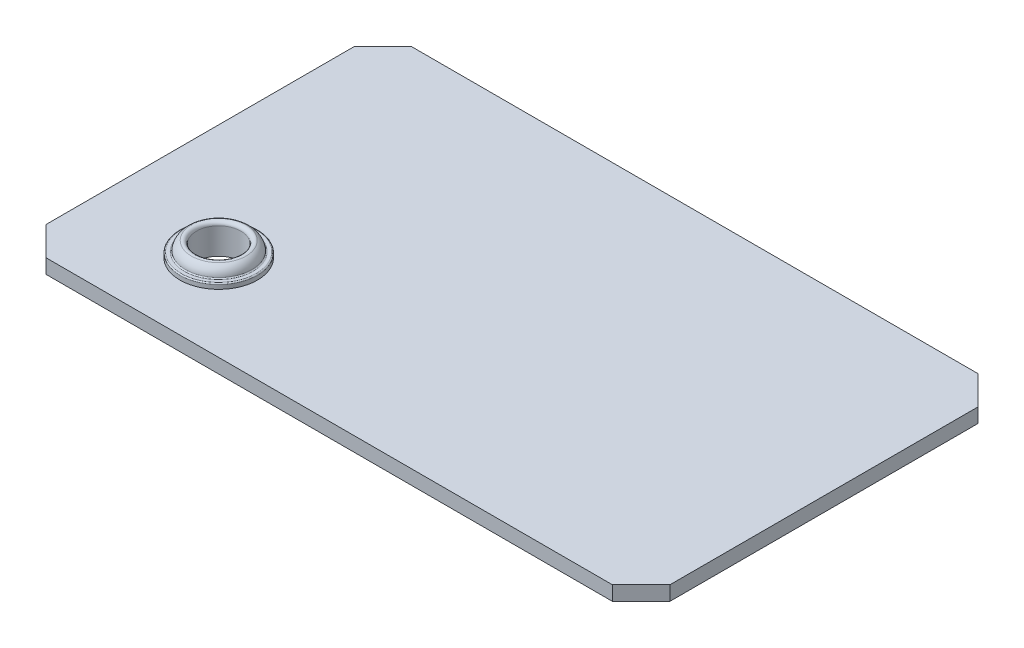
from build123d import *

# Parameters (mm, degrees)
EXTRUDE1_DEPTH = 3.175
SKETCH5_R      = 4.899523771
EXTRUDE2_DEPTH = 6.9215


with BuildPart() as part:
    # Sketch1 → Extrude1 (new body)
    with BuildSketch(Plane(origin=(0, 0, 0), x_dir=(1, 0, 0), z_dir=(0, 1, 0))):
        Polygon((131.293364516, 0), (137.643364516, 6.35), (137.643364516, 74.305125285), (131.293364516, 80.655125285), (6.35, 80.655125285), (0, 74.305125285), (0, 6.35), (6.35, 0), align=None)
    extrude(amount=-EXTRUDE1_DEPTH)

    # Sketch3 → Revolve1 (revolve)
    with BuildSketch(Plane.XY.offset(-19.05), mode=Mode.PRIVATE) as revolve1_sk:
        with BuildLine():
            Line((25.4, 0), (33.952460507, 0))
            Line((33.952460507, 0), (33.952460507, 0.90459086))
            ThreePointArc((33.952460507, 0.90459086), (33.87806563, 1.084195983), (33.698460507, 1.15859086))
            Line((33.698460507, 1.15859086), (32.962971663, 1.15859086))
            ThreePointArc((32.962971663, 1.15859086), (32.792104444, 1.224653653), (32.710118846, 1.388477524))
            ThreePointArc((32.710118846, 1.388477524), (32.305713436, 2.5146954), (31.411407987, 3.309760306))
            ThreePointArc((31.411407987, 3.309760306), (30.665271183, 3.28370412), (30.299523771, 2.632837093))
            Line((30.299523771, 2.632837093), (30.299523771, 1.803708053))
            Line((30.299523771, 1.803708053), (25.4, 1.803708053))
            Line((25.4, 1.803708053), (25.4, 0))
        make_face()
    revolve(revolve1_sk.sketch.rotate(Axis((25.4, 0, -19.05), (0, 1, 0)), 90), axis=Axis((25.4, 0, -19.05), (0, 1, 0)))

    # Sketch5 → Extrude2 (cut, symmetric)
    with BuildSketch(Plane(origin=(0, 0, 0), x_dir=(1, 0, 0), z_dir=(0, 1, 0))):
        with Locations(Location((25.4, 19.05, 0), (0, 0, 90))):
            Circle(SKETCH5_R)
    extrude(amount=EXTRUDE2_DEPTH, both=True, mode=Mode.SUBTRACT)


solid = part.part
